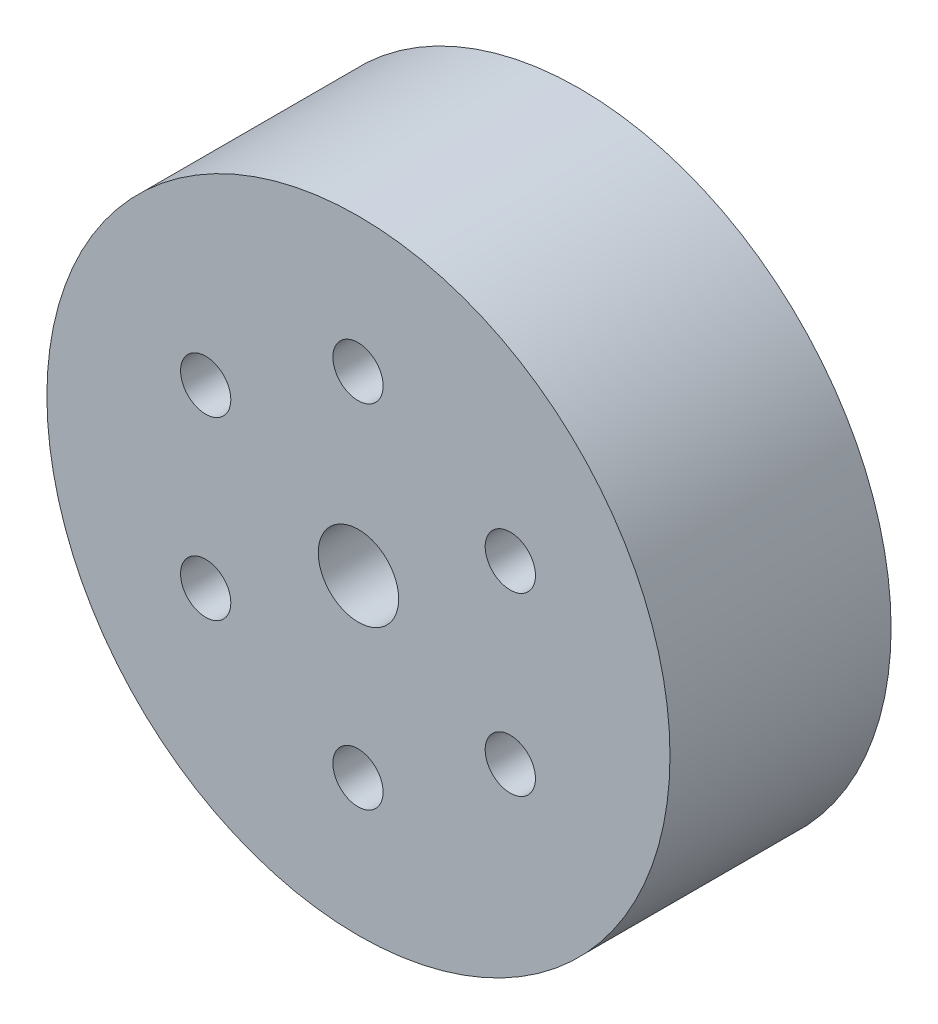
from build123d import *

# Parameters (mm, degrees)
SKETCH1_R           = 15.5
BOSS_EXTRUDE1_DEPTH = 11
SKETCH2_R           = 2
SKETCH2_R_2         = 1.25
CUT_EXTRUDE1_DEPTH  = 11


with BuildPart() as part:
    # Sketch1 → Boss-Extrude1 (new body)
    with BuildSketch(Plane.XY):
        Circle(SKETCH1_R)
    extrude(amount=BOSS_EXTRUDE1_DEPTH)

    # Sketch2 → Cut-Extrude1 (cut)
    with BuildSketch(Plane.XY.offset(11)):
        Circle(SKETCH2_R)
        with Locations((7.555298175, 4.413611842)):
            Circle(SKETCH2_R_2)
        with Locations((7.555079083, -4.336388156)):
            Circle(SKETCH2_R_2)
        with Locations((-0.022752744, -8.711198415)):
            Circle(SKETCH2_R_2)
        with Locations((-7.600365479, -4.336008677)):
            Circle(SKETCH2_R_2)
        with Locations((-7.600146387, 4.413991321)):
            Circle(SKETCH2_R_2)
        with Locations((-0.02231456, 8.78880158)):
            Circle(SKETCH2_R_2)
    extrude(amount=-CUT_EXTRUDE1_DEPTH, mode=Mode.SUBTRACT)


solid = part.part
